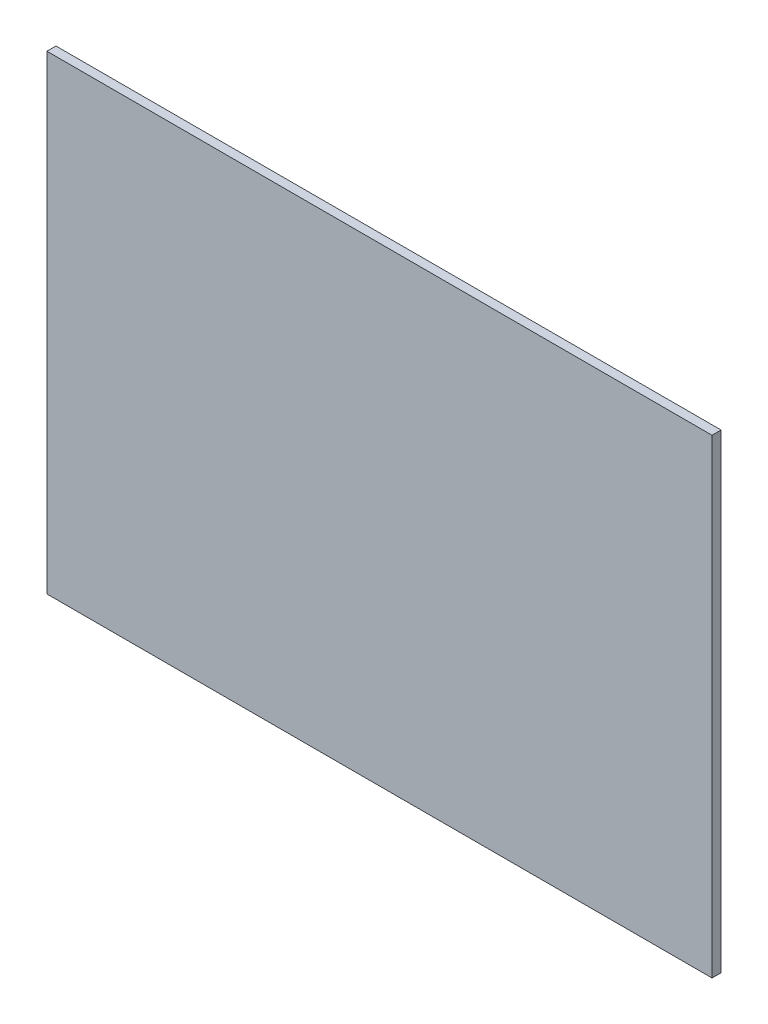
from build123d import *

# Parameters (mm, degrees)
SKETCH1_W           = 73.58
SKETCH1_H           = 52
BOSS_EXTRUDE1_DEPTH = 1


with BuildPart() as part:
    # Sketch1 → Boss-Extrude1 (new body)
    with BuildSketch(Plane.XY):
        Rectangle(SKETCH1_W, SKETCH1_H)
    extrude(amount=BOSS_EXTRUDE1_DEPTH)


solid = part.part
